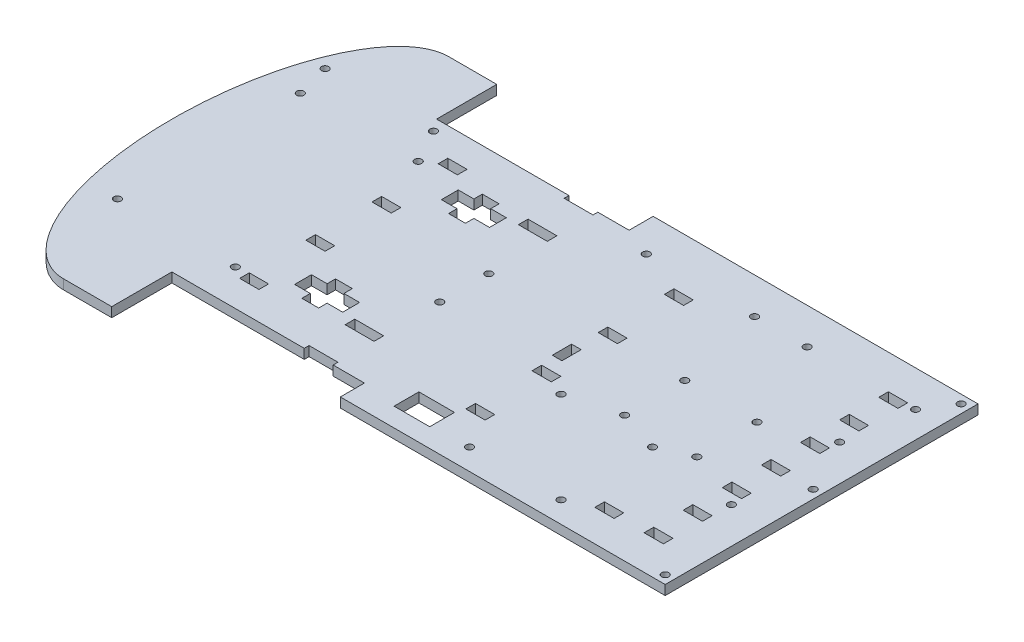
from build123d import *

# Parameters (mm, degrees)
BOSS_EXTRUDE1_DEPTH = 4
SKETCH3_R           = 1.5
CUT_EXTRUDE1_DEPTH  = 212.025041063
SKETCH4_W           = 8
SKETCH4_H           = 4
CUT_EXTRUDE2_DEPTH  = 216.443728284
SKETCH12_W          = 12
SKETCH12_H          = 2
SKETCH12_H_2        = 4
CUT_EXTRUDE8_DEPTH  = 216.443728284
SKETCH5_R           = 1.5
SKETCH5_W           = 4
SKETCH5_H           = 8
CUT_EXTRUDE3_DEPTH  = 216.443728284
SKETCH7_W           = 14.8
SKETCH7_H           = 10.3
CUT_EXTRUDE4_DEPTH  = 216.443728284
SKETCH8_R           = 1.5
CUT_EXTRUDE5_DEPTH  = 193.963810644
SKETCH9_W           = 8
SKETCH9_H           = 4
CUT_EXTRUDE6_DEPTH  = 216.443728284
SKETCH10_R          = 1.5
CUT_EXTRUDE7_DEPTH  = 216.443728284
SKETCH13_W          = 8
SKETCH13_H          = 4
CUT_EXTRUDE9_DEPTH  = 216.443728284
SKETCH14_R          = 1.5
CUT_EXTRUDE10_DEPTH = 216.443728284
SKETCH15_R          = 1.5
CUT_EXTRUDE11_DEPTH = 216.443728284


with BuildPart() as part:
    # Sketch1 → Boss-Extrude1 (new body)
    with BuildSketch(Plane(origin=(0, 0, 0), x_dir=(1, 0, 0), z_dir=(0, 1, 0))):
        with BuildLine():
            Line((-70, -55), (-145, -55))
            Line((-145, -55), (-145, -80))
            Line((-145, -80), (-165, -80))
            add(Edge.make_bspline(
                [(-165, 80), (-200, 80), (-200, 0), (-200, -80), (-165, -80)],
                knots=[0, 0, 0, 1.570796327, 1.570796327, 3.141592654, 3.141592654, 3.141592654], degree=2, weights=[1, 0.707106781, 1, 0.707106781, 1]))
            Line((-165, 80), (-145, 80))
            Line((-145, 80), (-145, 55))
            Line((-145, 55), (-70, 55))
            Line((-70, 55), (-65, 55))
            Line((-65, 55), (-65, 65))
            Line((-65, 65), (70, 65))
            Line((70, 65), (70, -65))
            Line((70, -65), (-65, -65))
            Line((-65, -65), (-65, -55))
            Line((-65, -55), (-70, -55))
        make_face()
    extrude(amount=BOSS_EXTRUDE1_DEPTH)

    # Sketch3 → Cut-Extrude1 (cut, through all)
    with BuildSketch(Plane(origin=(-6.985602404, 4, -5.211561537), x_dir=(1, 0, 0), z_dir=(0, 1, 0))):
        with Locations(Location((-175.616883117, 30.75, 0), (0, 0, 270))):
            Circle(SKETCH3_R)
        with Locations(Location((-126.616883117, -45.25, 0), (0, 0, 270))):
            Circle(SKETCH3_R)
        with Locations(Location((-175.616883117, -45.25, 0), (0, 0, 270))):
            Circle(SKETCH3_R)
        with Locations(Location((-126.616883117, 30.75, 0), (0, 0, 270))):
            Circle(SKETCH3_R)
    extrude(amount=-CUT_EXTRUDE1_DEPTH, mode=Mode.SUBTRACT)

    # Sketch4 → Cut-Extrude2 (cut, through all)
    with BuildSketch(Plane(origin=(0, 4, 0), x_dir=(1, 0, 0), z_dir=(0, 1, 0))):
        with Locations((-124.591012162, 13.75)):
            Rectangle(SKETCH4_W, SKETCH4_H)
        with Locations((-124.591012162, 41.25)):
            Rectangle(SKETCH4_W, SKETCH4_H)
        with Locations((-124.591012162, -13.75)):
            Rectangle(SKETCH4_W, SKETCH4_H)
        with Locations((-124.591012162, -41.25)):
            Rectangle(SKETCH4_W, SKETCH4_H)
        with Locations((-30.591012162, 41.25)):
            Rectangle(SKETCH4_W, SKETCH4_H)
        with Locations((-30.591012162, 13.75)):
            Rectangle(SKETCH4_W, SKETCH4_H)
        with Locations((-30.591012162, -13.75)):
            Rectangle(SKETCH4_W, SKETCH4_H)
        with Locations((-30.591012162, -41.25)):
            Rectangle(SKETCH4_W, SKETCH4_H)
    extrude(amount=-CUT_EXTRUDE2_DEPTH, mode=Mode.SUBTRACT)

    # Sketch12 → Cut-Extrude8 (cut, through all)
    with BuildSketch(Plane(origin=(0, 4, 0), x_dir=(1, 0, 0), z_dir=(0, 1, 0))):
        with Locations((-84, 54)):
            Rectangle(SKETCH12_W, SKETCH12_H)
        with Locations((-84, -54)):
            Rectangle(SKETCH12_W, SKETCH12_H)
        with Locations((-84, -36)):
            Rectangle(SKETCH12_W, SKETCH12_H_2)
        Polygon((-115, -27), (-108.5, -27), (-108.5, -23.5), (-101.5, -23.5), (-101.5, -27), (-95, -27), (-95, -34), (-101.5, -34), (-101.5, -37.5), (-108.5, -37.5), (-108.5, -34), (-115, -34), align=None)
        with Locations((-84, 36)):
            Rectangle(SKETCH12_W, SKETCH12_H_2)
        Polygon((-101.5, 37.5), (-101.5, 34), (-95, 34), (-95, 27), (-101.5, 27), (-101.5, 23.5), (-108.5, 23.5), (-108.5, 27), (-115, 27), (-115, 34), (-108.5, 34), (-108.5, 37.5), align=None)
    extrude(amount=-CUT_EXTRUDE8_DEPTH, mode=Mode.SUBTRACT)

    # Sketch5 → Cut-Extrude3 (cut, through all)
    with BuildSketch(Plane(origin=(0, 4, 0), x_dir=(1, 0, 0), z_dir=(0, 1, 0))):
        with Locations(Location((-78.5, 10.2, 0), (0, 0, 270))):
            Circle(SKETCH5_R)
        with Locations(Location((-78.5, -10.199999999, 0), (0, 0, 90))):
            Circle(SKETCH5_R)
        with Locations((-33.972444042, -1.934244663)):
            Rectangle(SKETCH5_W, SKETCH5_H)
    extrude(amount=-CUT_EXTRUDE3_DEPTH, mode=Mode.SUBTRACT)

    # Sketch7 → Cut-Extrude4 (cut, through all)
    with BuildSketch(Plane(origin=(0, 4, 0), x_dir=(1, 0, 0), z_dir=(0, 1, 0))):
        with Locations((-43.111193568, -52)):
            Rectangle(SKETCH7_W, SKETCH7_H)
    extrude(amount=-CUT_EXTRUDE4_DEPTH, mode=Mode.SUBTRACT)

    # Sketch8 → Cut-Extrude5 (cut, through all)
    with BuildSketch(Plane(origin=(-25.427645794, 4, 2.118970483), x_dir=(1, 0, 0), z_dir=(0, 1, 0))):
        with Locations(Location((5.310001272, -16.0521097, 0), (0, 0, 270))):
            Circle(SKETCH8_R)
        with Locations(Location((43.310001272, -16.0521097, 0), (0, 0, 270))):
            Circle(SKETCH8_R)
        with Locations(Location((43.310001272, -54.0521097, 0), (0, 0, 270))):
            Circle(SKETCH8_R)
        with Locations(Location((5.310001272, -54.0521097, 0), (0, 0, 270))):
            Circle(SKETCH8_R)
    extrude(amount=-CUT_EXTRUDE5_DEPTH, mode=Mode.SUBTRACT)

    # Sketch9 → Cut-Extrude6 (cut, through all)
    with BuildSketch(Plane(origin=(0, 4, 0), x_dir=(1, 0, 0), z_dir=(0, 1, 0))):
        with Locations((51, -16.25)):
            Rectangle(SKETCH9_W, SKETCH9_H)
        with Locations((51, 0)):
            Rectangle(SKETCH9_W, SKETCH9_H)
        with Locations((51, -32.5)):
            Rectangle(SKETCH9_W, SKETCH9_H)
        with Locations((51, -48.75)):
            Rectangle(SKETCH9_W, SKETCH9_H)
        with Locations((51, 48.75)):
            Rectangle(SKETCH9_W, SKETCH9_H)
        with Locations((51, 32.5)):
            Rectangle(SKETCH9_W, SKETCH9_H)
        with Locations((51, 16.25)):
            Rectangle(SKETCH9_W, SKETCH9_H)
    extrude(amount=-CUT_EXTRUDE6_DEPTH, mode=Mode.SUBTRACT)

    # Sketch10 → Cut-Extrude7 (cut, through all)
    with BuildSketch(Plane(origin=(0, 4, 0), x_dir=(1, 0, 0), z_dir=(0, 1, 0))):
        with Locations(Location((30.634993505, 12.5, 0), (0, 0, 270))):
            Circle(SKETCH10_R)
        with Locations(Location((0.634993505, 12.5, 0), (0, 0, 270))):
            Circle(SKETCH10_R)
        with Locations(Location((30.634993505, -12.5, 0), (0, 0, 270))):
            Circle(SKETCH10_R)
        with Locations(Location((0.634993505, -12.5, 0), (0, 0, 270))):
            Circle(SKETCH10_R)
    extrude(amount=-CUT_EXTRUDE7_DEPTH, mode=Mode.SUBTRACT)

    # Sketch13 → Cut-Extrude9 (cut, through all)
    with BuildSketch(Plane(origin=(0, 4, 0), x_dir=(1, 0, 0), z_dir=(0, 1, 0))):
        with Locations((31.615955473, -49.849103278)):
            Rectangle(SKETCH13_W, SKETCH13_H)
    extrude(amount=-CUT_EXTRUDE9_DEPTH, mode=Mode.SUBTRACT)

    # Sketch14 → Cut-Extrude10 (cut, through all)
    with BuildSketch(Plane(origin=(0, 4, 0), x_dir=(1, 0, 0), z_dir=(0, 1, 0))):
        with Locations(Location((66.5, 61.5, 0), (0, 0, 270))):
            Circle(SKETCH14_R)
        with Locations(Location((66.5, 0, 0), (0, 0, 270))):
            Circle(SKETCH14_R)
        with Locations(Location((66.5, -61.5, 0), (0, 0, 90))):
            Circle(SKETCH14_R)
    extrude(amount=-CUT_EXTRUDE10_DEPTH, mode=Mode.SUBTRACT)

    # Sketch15 → Cut-Extrude11 (cut, through all)
    with BuildSketch(Plane(origin=(0, 4, 0), x_dir=(1, 0, 0), z_dir=(0, 1, 0))):
        with Locations(Location((59, 50, 0), (0, 0, 270))):
            Circle(SKETCH15_R)
        with Locations(Location((14, 50, 0), (0, 0, 270))):
            Circle(SKETCH15_R)
        with Locations(Location((-52.848681511, 50, 0), (0, 0, 270))):
            Circle(SKETCH15_R)
        with Locations(Location((-7.848681511, 50, 0), (0, 0, 270))):
            Circle(SKETCH15_R)
        with Locations(Location((-186.321866243, 50, 0), (0, 0, 270))):
            Circle(SKETCH15_R)
        with Locations(Location((-141.321866243, 50, 0), (0, 0, 270))):
            Circle(SKETCH15_R)
        with Locations(Location((55, 22.5, 0), (0, 0, 270))):
            Circle(SKETCH15_R)
        with Locations(Location((55, -22.5, 0), (0, 0, 270))):
            Circle(SKETCH15_R)
    extrude(amount=-CUT_EXTRUDE11_DEPTH, mode=Mode.SUBTRACT)


solid = part.part
